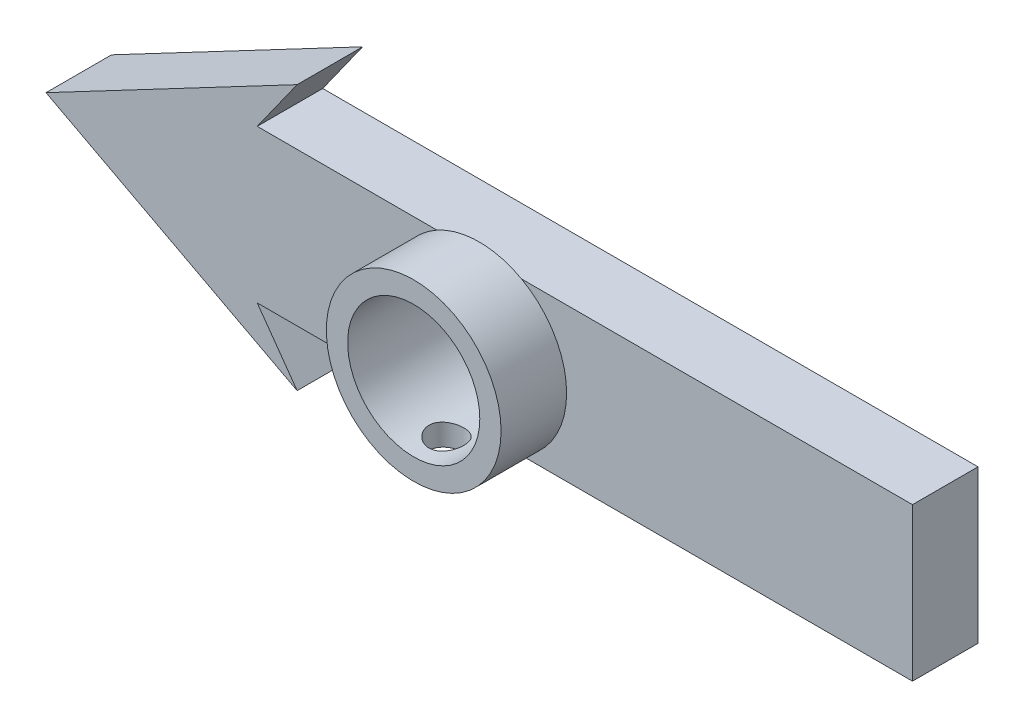
from build123d import *

# Parameters (mm, degrees)
BOSS_EXTRUDE1_DEPTH     = 3
SKETCH8_R               = 4
BOSS_EXTRUDE4_DEPTH     = 3
CUT_EXTRUDE5_REACH      = 42.577
SKETCH9_R               = 3.025
CUT_EXTRUDE6_REACH      = 42.577
CUT_EXTRUDE6_END_RADIUS = 4
SKETCH10_R              = 0.8


with BuildPart() as part:
    # Sketch3 → Boss-Extrude1 (new body)
    with BuildSketch(Plane.XY):
        Polygon((0, 0), (11.497632607, 6.066666667), (9.670080369, 3.5), (39.670080369, 3.5), (39.670080369, -3.5), (9.670080369, -3.5), (11.497632607, -6.066666667), align=None)
    extrude(amount=BOSS_EXTRUDE1_DEPTH)

    # Sketch8 → Boss-Extrude4 (add)
    with BuildSketch(Plane.XY.offset(3)):
        with Locations(Location((19.835040185, 0, 0), (0, 0, 118.955024372))):
            Circle(SKETCH8_R)
    extrude(amount=BOSS_EXTRUDE4_DEPTH)

    # Sketch9 → Cut-Extrude5 (cut, up to next)
    with BuildSketch(Plane.XY.offset(6), mode=Mode.PRIVATE) as cut_extrude5_sk1:
        with Locations((19.835040185, 0)):
            Circle(SKETCH9_R)
    cut_extrude5_tool1 = extrude(cut_extrude5_sk1.sketch, amount=-CUT_EXTRUDE5_REACH, mode=Mode.PRIVATE) & part.part
    add(cut_extrude5_tool1.solids().sort_by_distance((19.83504, 0, 6))[0], mode=Mode.SUBTRACT)

    # Cut-Extrude6: up to this cylinder (the profile starts inside it)
    cut_extrude6_end = Plane(origin=(19.835040185, 0, 4.5), z_dir=(0, 0, -1)) * Cylinder(CUT_EXTRUDE6_END_RADIUS, 94.154, mode=Mode.PRIVATE)
    # Sketch10 → Cut-Extrude6 (cut, up to the surface)
    with BuildSketch(Plane(origin=(0, 0, 0), x_dir=(1, 0, 0), z_dir=(0, 1, 0)), mode=Mode.PRIVATE) as cut_extrude6_sk1:
        with Locations(Location((19.835040185, -4.5, 0), (0, 0, 270))):
            Circle(SKETCH10_R)
    cut_extrude6_tool1 = extrude(cut_extrude6_sk1.sketch, amount=-CUT_EXTRUDE6_REACH, mode=Mode.PRIVATE) & cut_extrude6_end
    add(cut_extrude6_tool1.solids().sort_by_distance((19.83504, 0, 4.5))[0], mode=Mode.SUBTRACT)


solid = part.part
